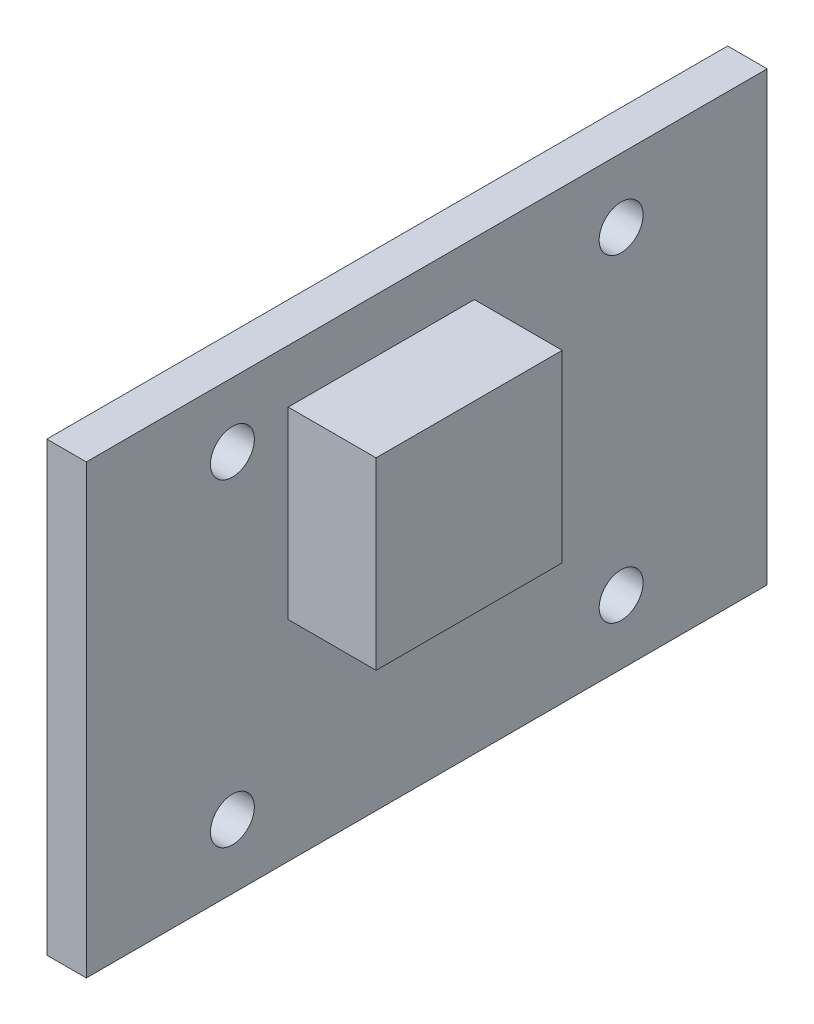
from build123d import *

# Parameters (mm, degrees)
SKETCH1_W           = 31
SKETCH1_H           = 20.35
SKETCH1_R           = 1
BOSS_EXTRUDE1_DEPTH = 1.8
SKETCH2_W           = 8.476659679
SKETCH2_H           = 8.378852068
BOSS_EXTRUDE2_DEPTH = 4


with BuildPart() as part:
    # Sketch1 → Boss-Extrude1 (new body)
    with BuildSketch(Plane(origin=(0, 0, 0), x_dir=(0, 0, -1), z_dir=(1, 0, 0))):
        with Locations((15.5, 10.175)):
            Rectangle(SKETCH1_W, SKETCH1_H)
        with Locations((6.65, 2.925)):
            Circle(SKETCH1_R, mode=Mode.SUBTRACT)
        with Locations((6.65, 17.425)):
            Circle(SKETCH1_R, mode=Mode.SUBTRACT)
        with Locations((24.35, 17.425)):
            Circle(SKETCH1_R, mode=Mode.SUBTRACT)
        with Locations((24.35, 2.925)):
            Circle(SKETCH1_R, mode=Mode.SUBTRACT)
    extrude(amount=BOSS_EXTRUDE1_DEPTH)

    # Sketch2 → Boss-Extrude2 (add)
    with BuildSketch(Plane(origin=(1.8, 0, 0), x_dir=(0, 0, -1), z_dir=(1, 0, 0))):
        with Locations((13.429738887, 13.726682865)):
            Rectangle(SKETCH2_W, SKETCH2_H)
    extrude(amount=BOSS_EXTRUDE2_DEPTH)


solid = part.part
